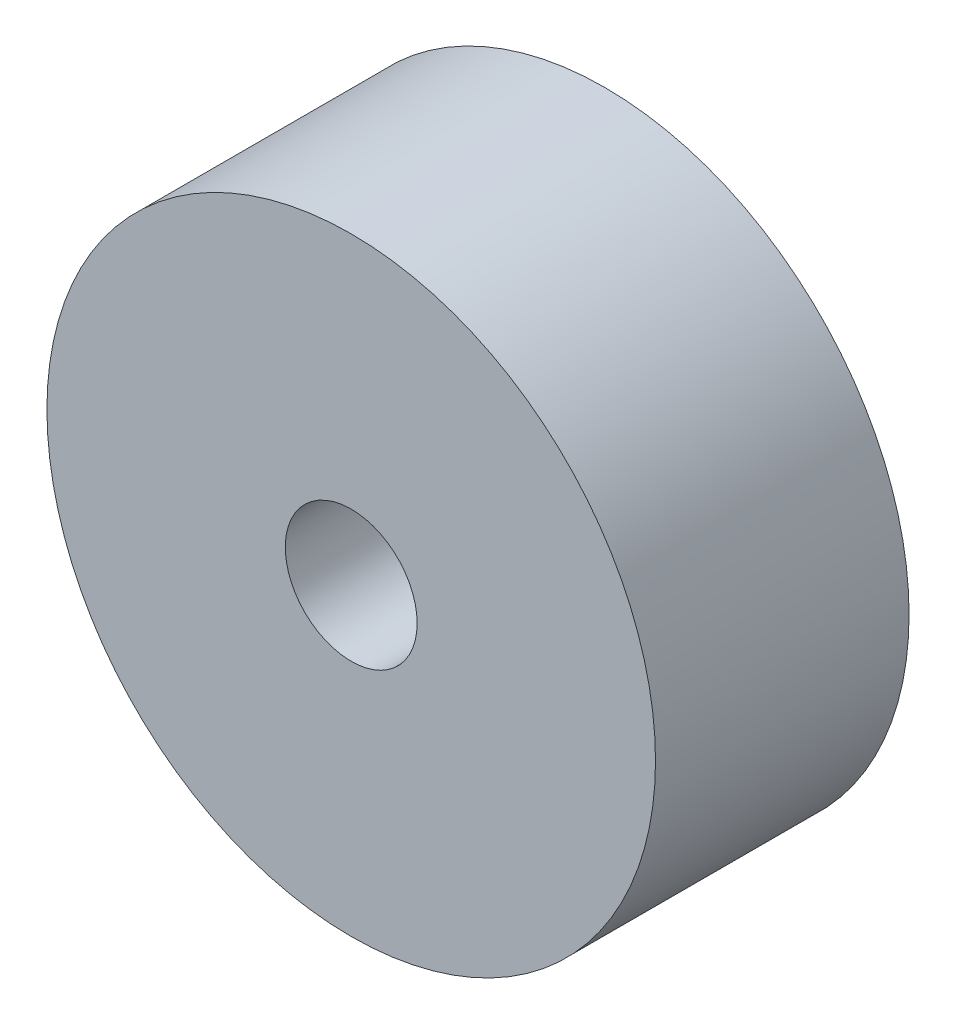
from build123d import *

# Parameters (mm, degrees)
SKETCH1_R           = 6
SKETCH1_R_2         = 1.3
BOSS_EXTRUDE5_DEPTH = 5


with BuildPart() as part:
    # Sketch1 → Boss-Extrude5 (new body)
    with BuildSketch(Plane.XY):
        Circle(SKETCH1_R)
        Circle(SKETCH1_R_2, mode=Mode.SUBTRACT)
    extrude(amount=BOSS_EXTRUDE5_DEPTH)


solid = part.part
